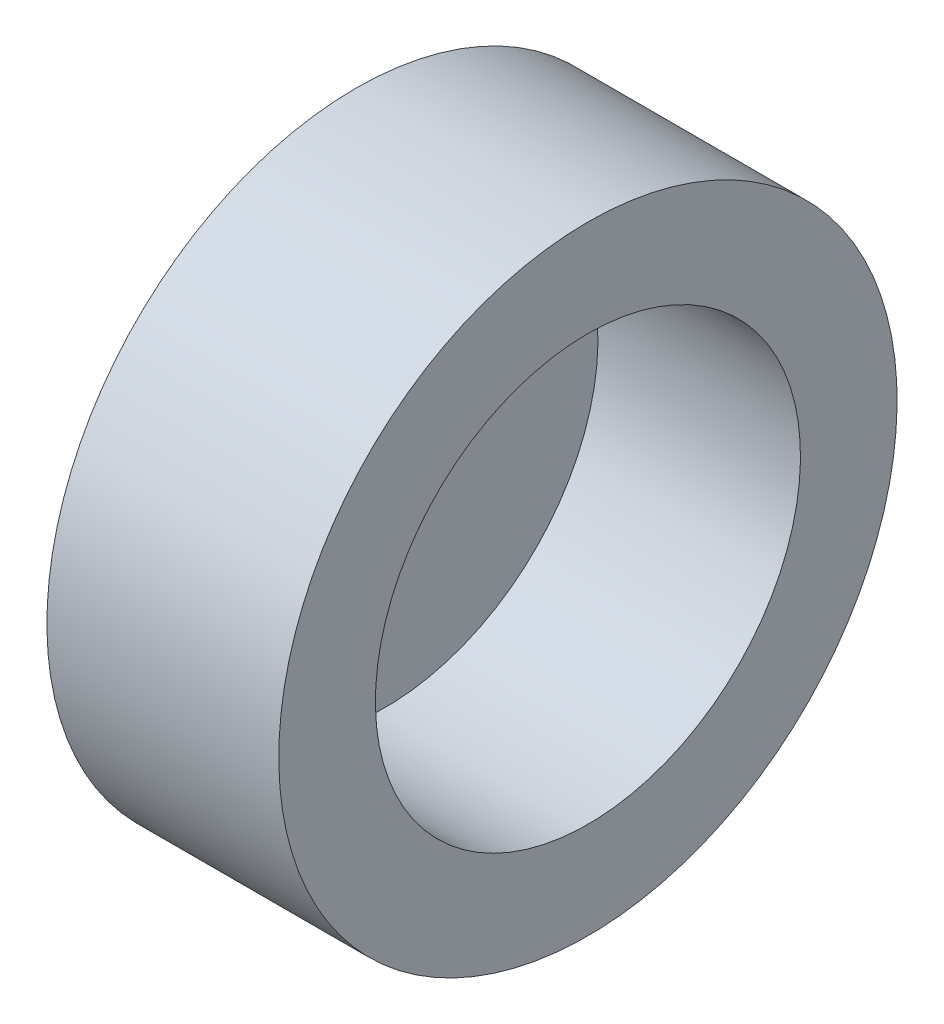
from build123d import *


with BuildPart() as part:
    # Esboço1 → Revolução1 (revolve)
    with BuildSketch(Plane.XY):
        Polygon((-3, 5), (-3, 16.195796127), (9, 16.195796127), (9, 11.195796127), (-1.480980428, 11.195796127), (-1.480980428, 2), (-8.480980428, 2), (-8.480980428, 5), align=None)
    revolve(axis=Axis((0, 0.195796127, 0), (-1, 0, 0)))


solid = part.part
